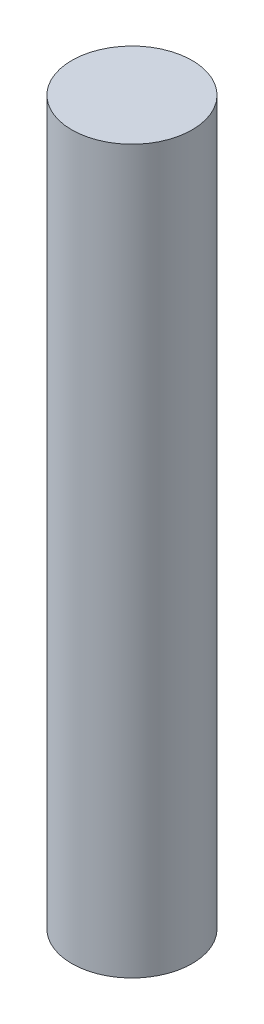
from build123d import *

# Parameters (mm, degrees)
SKETCH1_R           = 187.5
BOSS_EXTRUDE1_DEPTH = 2250


with BuildPart() as part:
    # Sketch1 → Boss-Extrude1 (new body)
    with BuildSketch(Plane(origin=(0, 0, 0), x_dir=(1, 0, 0), z_dir=(0, 1, 0))):
        with Locations(Location((-123.63241419, -140.965514086, 0), (0, 0, 270))):
            Circle(SKETCH1_R)
    extrude(amount=BOSS_EXTRUDE1_DEPTH)


solid = part.part
